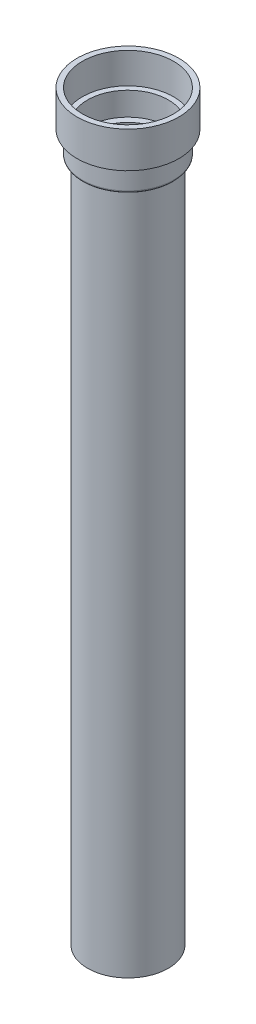
from build123d import *

# Parameters (mm, degrees)
FILLET2_R = 1


with BuildPart() as part:
    # Sketch1 → Revolve1 (revolve)
    with BuildSketch(Plane(origin=(0, 0, 0), x_dir=(0, 0, -1), z_dir=(1, 0, 0))):
        Polygon((-21.5, 0), (-24, 0), (-24, -17), (-21.5, -17), (-21.5, -28), (-19, -28), (-19, -350), (0, -350), (0, -347.5), (-16, -347.5), (-16, -345.435797774), (-16, -25.5), (-19, -25.5), (-19, -14.5), (-21.5, -14.5), align=None)
    revolve(axis=Axis((0, 0, 0), (0, -1, 0)))

    # Fillet2
    fillet2_edges = [part.edges().sort_by_distance(p)[0] for p in [
        (0, -28, -21.5),
    ]]
    fillet(fillet2_edges, radius=FILLET2_R)


solid = part.part
